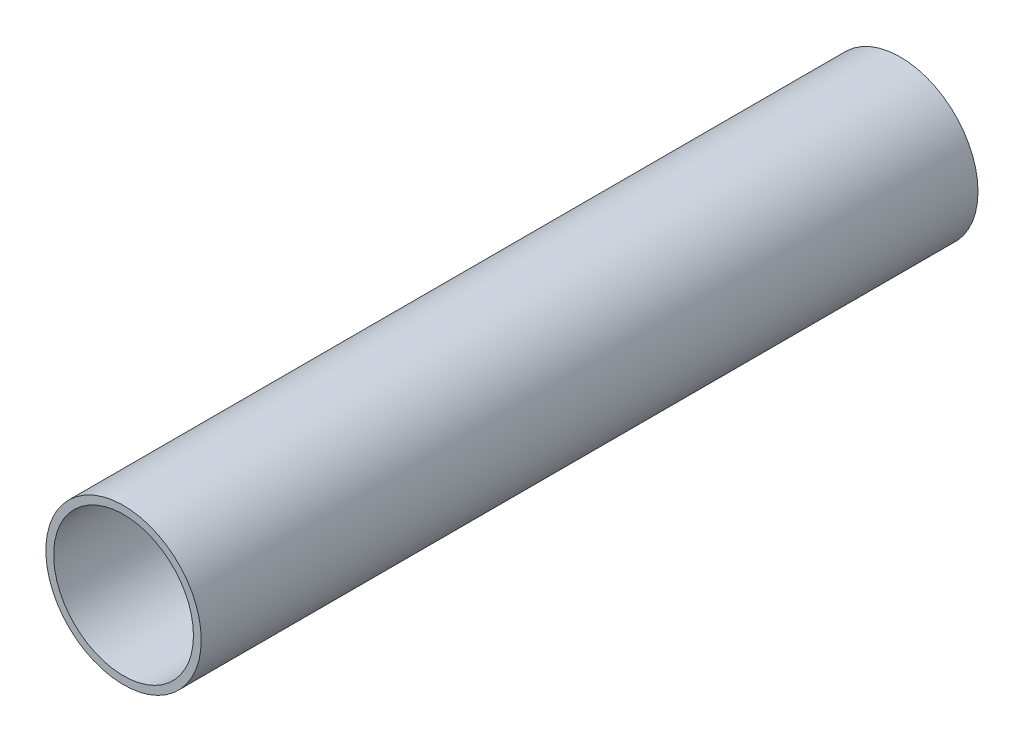
from build123d import *

# Parameters (mm, degrees)
SKETCH1_R           = 8
SKETCH1_R_2         = 7.2
BOSS_EXTRUDE1_DEPTH = 40


with BuildPart() as part:
    # Sketch1 → Boss-Extrude1 (new, symmetric)
    with BuildSketch(Plane.XY):
        Circle(SKETCH1_R)
        Circle(SKETCH1_R_2, mode=Mode.SUBTRACT)
    extrude(amount=BOSS_EXTRUDE1_DEPTH, both=True)


solid = part.part
